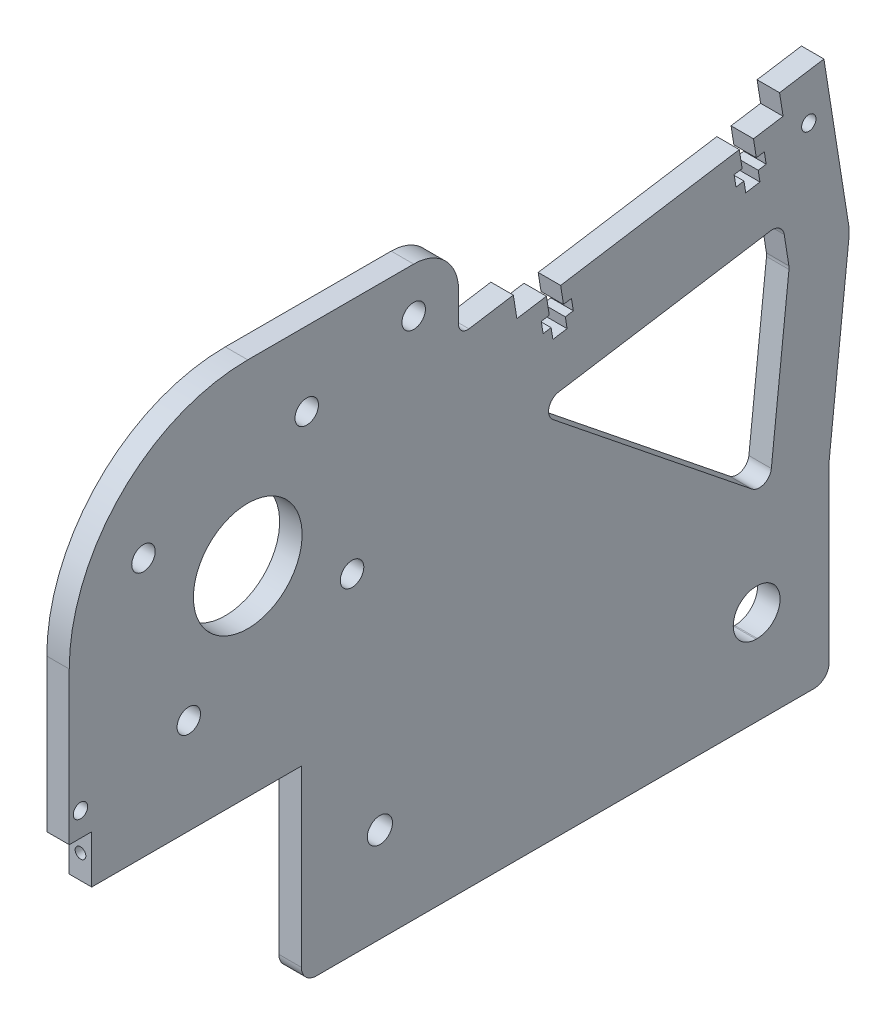
from build123d import *

# Parameters (mm, degrees)
SKETCH1_R           = 2.4892
SKETCH1_R_2         = 2.667
SKETCH1_R_3         = 1.524
SKETCH1_R_4         = 11.522750336
BOSS_EXTRUDE1_DEPTH = 4.7625
SKETCH2_R           = 1.1303
CUT_EXTRUDE1_DEPTH  = 6.35


with BuildPart() as part:
    # Sketch1 → Boss-Extrude1 (new body)
    with BuildSketch(Plane(origin=(0, 0, 0), x_dir=(0, 0, -1), z_dir=(1, 0, 0))):
        with BuildLine():
            Line((-28.170295117, 0), (77.382795117, 0))
            ThreePointArc((77.382795117, 0), (79.627859148, 0.92993597), (80.557795117, 3.175))
            Line((80.557795117, 3.175), (80.557795117, 40.132))
            Line((80.557795117, 40.132), (84.771740045, 79.196103092))
            ThreePointArc((84.771740045, 79.196103092), (84.816236398, 80.272287311), (84.718413682, 81.344939685))
            Line((84.718413682, 81.344939685), (79.457064092, 114.563793628))
            Line((79.457064092, 114.563793628), (70.049332648, 113.073755348))
            Line((70.049332648, 113.073755348), (70.794351787, 108.369889626))
            Line((70.794351787, 108.369889626), (64.522530825, 107.376530773))
            Line((64.522530825, 107.376530773), (65.123512931, 103.582079091))
            Line((65.123512931, 103.582079091), (66.816904591, 103.850285981))
            Line((66.816904591, 103.850285981), (67.209281338, 101.372916701))
            Line((67.209281338, 101.372916701), (65.515889678, 101.10470981))
            Line((65.515889678, 101.10470981), (65.888399247, 98.752776949))
            Line((65.888399247, 98.752776949), (62.877925185, 98.2759647))
            Line((62.877925185, 98.2759647), (62.505415615, 100.627897561))
            Line((62.505415615, 100.627897561), (60.812023956, 100.359690671))
            Line((60.812023956, 100.359690671), (60.419647209, 102.837059951))
            Line((60.419647209, 102.837059951), (62.113038869, 103.105266841))
            Line((62.113038869, 103.105266841), (61.512056762, 106.899718524))
            Line((61.512056762, 106.899718524), (23.630258147, 100.899831052))
            Line((23.630258147, 100.899831052), (24.231240253, 97.105379369))
            Line((24.231240253, 97.105379369), (25.924631913, 97.373586259))
            Line((25.924631913, 97.373586259), (26.31700866, 94.896216979))
            Line((26.31700866, 94.896216979), (24.623617, 94.628010089))
            Line((24.623617, 94.628010089), (24.99612657, 92.276077228))
            Line((24.99612657, 92.276077228), (21.985652508, 91.799264978))
            Line((21.985652508, 91.799264978), (21.613142938, 94.151197839))
            Line((21.613142938, 94.151197839), (19.919751278, 93.882990949))
            Line((19.919751278, 93.882990949), (19.527374531, 96.360360229))
            Line((19.527374531, 96.360360229), (21.220766191, 96.62856712))
            Line((21.220766191, 96.62856712), (20.619784085, 100.423018802))
            Line((20.619784085, 100.423018802), (14.347963122, 99.429659949))
            Line((14.347963122, 99.429659949), (13.602943983, 104.133525671))
            Line((13.602943983, 104.133525671), (4.195212538, 102.643487392))
            ThreePointArc((4.195212538, 102.643487392), (2.66000635, 103.076460316), (1.992204883, 104.52503368))
            Line((1.992204883, 104.52503368), (1.992204883, 110.875))
            ThreePointArc((1.992204883, 110.875), (-0.797603027, 117.610192091), (-7.532795117, 120.4))
            Line((-7.532795117, 120.4), (-42.707795117, 120.4))
            ThreePointArc((-42.707795117, 120.4), (-69.471786785, 109.313991668), (-80.557795117, 82.55))
            Line((-80.557795117, 82.55), (-80.557795117, 50.292))
            Line((-80.557795117, 50.292), (-75.795295117, 50.292))
            Line((-75.795295117, 50.292), (-75.795295117, 40.132))
            Line((-75.795295117, 40.132), (-31.345295117, 40.132))
            Line((-31.345295117, 40.132), (-31.345295117, 3.175))
            ThreePointArc((-31.345295117, 3.175), (-30.415359148, 0.92993597), (-28.170295117, 0))
        make_face()
        with Locations(Location((-55.209041359, 60.43939525, 0), (0, 0, 180))):
            Circle(SKETCH1_R, mode=Mode.SUBTRACT)
        with Locations(Location((-14.692204883, 20.066, 0), (0, 0, 180))):
            Circle(SKETCH1_R_2, mode=Mode.SUBTRACT)
        with Locations(Location((-20.597190367, 70.048753759, 0), (0, 0, 180))):
            Circle(SKETCH1_R, mode=Mode.SUBTRACT)
        with Locations(Location((-64.818399868, 95.051246241, 0), (0, 0, 180))):
            Circle(SKETCH1_R, mode=Mode.SUBTRACT)
        with Locations(Location((-30.206548876, 104.66060475, 0), (0, 0, 180))):
            Circle(SKETCH1_R, mode=Mode.SUBTRACT)
        with Locations(Location((-78.176545117, 55.372, 0), (0, 0, 180))):
            Circle(SKETCH1_R_3, mode=Mode.SUBTRACT)
        with Locations(Location((-42.707795117, 82.55, 0), (0, 0, 180))):
            Circle(SKETCH1_R_4, mode=Mode.SUBTRACT)
        with Locations(Location((-7.532795117, 110.875, 0), (0, 0, 180))):
            Circle(SKETCH1_R, mode=Mode.SUBTRACT)
        with Locations(Location((76.243236649, 104.411043044, 0), (0, 0, 180))):
            Circle(SKETCH1_R_3, mode=Mode.SUBTRACT)
        with BuildLine():
            Line((65.317795117, 15.2273), (65.063795117, 15.2273))
            ThreePointArc((65.063795117, 15.2273), (60.225095117, 20.066), (65.063795117, 24.9047))
            Line((65.063795117, 24.9047), (65.317795117, 24.9047))
            ThreePointArc((65.317795117, 24.9047), (70.156495117, 20.066), (65.317795117, 15.2273))
        make_face(mode=Mode.SUBTRACT)
        with BuildLine():
            Line((71.035861406, 86.549018926), (72.027193342, 80.289995416))
            ThreePointArc((72.027193342, 80.289995416), (72.057683184, 79.9556661), (72.043814352, 79.620235963))
            Line((72.043814352, 79.620235963), (68.302723543, 44.939584088))
            ThreePointArc((68.302723543, 44.939584088), (66.751491112, 42.866217372), (64.187855338, 43.230831164))
            Line((64.187855338, 43.230831164), (22.026684653, 77.057314107))
            ThreePointArc((22.026684653, 77.057314107), (21.161269703, 79.690326664), (23.218859921, 81.547211328))
            Line((23.218859921, 81.547211328), (68.12978948, 88.66040377))
            ThreePointArc((68.12978948, 88.66040377), (70.020107562, 88.206578551), (71.035861406, 86.549018926))
        make_face(mode=Mode.SUBTRACT)
    extrude(amount=BOSS_EXTRUDE1_DEPTH)

    # Sketch2 → Cut-Extrude1 (cut)
    with BuildSketch(Plane.XY.offset(75.795295117)):
        with Locations((2.38125, 45.212)):
            Circle(SKETCH2_R)
    extrude(amount=-CUT_EXTRUDE1_DEPTH, mode=Mode.SUBTRACT)


solid = part.part
